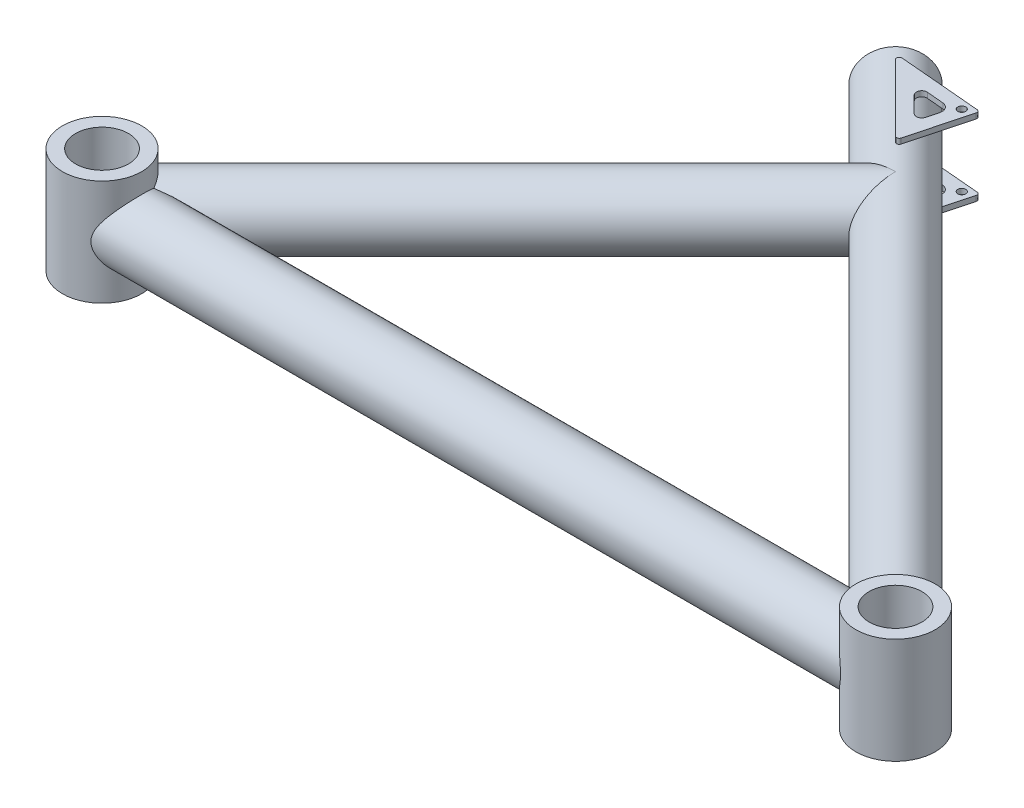
from build123d import *

# Parameters (mm, degrees)
CROQUIS1_R              = 15
SALIENTE_EXTRUIR1_DEPTH = 20
CROQUIS9_R              = 15
SALIENTE_EXTRUIR5_DEPTH = 20
CROQUIS10_W             = 300
CROQUIS10_H             = 12.5
CROQUIS12_R             = 12.5
SALIENTE_EXTRUIR6_DEPTH = 270
CROQUIS18_R             = 10
CORTAR_EXTRUIR1_DEPTH   = 376.137474949
CROQUIS19_R             = 1.5
SALIENTE_EXTRUIR7_DEPTH = 2
REDONDEO1_R             = 1
CROQUIS20_R             = 1.5
SALIENTE_EXTRUIR8_DEPTH = 2
CROQUIS21_R             = 7.5
CORTAR_EXTRUIR2_DEPTH   = 250


with BuildPart() as part:
    # Croquis1 → Saliente-Extruir1 (new, symmetric)
    with BuildSketch(Plane(origin=(0, 0, 0), x_dir=(1, 0, 0), z_dir=(0, 1, 0))):
        with Locations(Location((0, 0, 0), (0, 0, 270))):
            Circle(CROQUIS1_R)
    extrude(amount=SALIENTE_EXTRUIR1_DEPTH, both=True)



with BuildPart() as body_2:
    # Croquis9 → Saliente-Extruir5 (new, symmetric)
    with BuildSketch(Plane(origin=(0, 0, 0), x_dir=(1, 0, 0), z_dir=(0, 1, 0))):
        with Locations(Location((300, 0, 0), (0, 0, 270))):
            Circle(CROQUIS9_R)
    extrude(amount=SALIENTE_EXTRUIR5_DEPTH, both=True)


with BuildPart() as part_1:
    add(part.part)

    add(body_2.part)  # Revolución1 merges body 2
    # Croquis10 → Revolución1 (revolve)
    with BuildSketch(Plane.XY, mode=Mode.PRIVATE) as revoluci_n1_sk:
        with Locations((150, 6.25)):
            Rectangle(CROQUIS10_W, CROQUIS10_H)
    revolve(revoluci_n1_sk.sketch.rotate(Axis((0, 0, 0), (1, 0, 0)), 90), axis=Axis((0, 0, 0), (1, 0, 0)))

    # Croquis12 → Saliente-Extruir6 (add)
    with BuildSketch(Plane(origin=(150, 0, 150), x_dir=(-0.7071067811865456, 0, 0.7071067811865495), z_dir=(-0.7071067811865495, 0, -0.7071067811865456))):
        with Locations(Location((-212.132034356, 0, 0), (0, 0, 297.336794427))):
            Circle(CROQUIS12_R)
    extrude(amount=SALIENTE_EXTRUIR6_DEPTH)

    # Croquis17 → Revolución2 (revolve)
    with BuildSketch(Plane(origin=(0, 0, 0), x_dir=(1, 0, 0), z_dir=(0, 1, 0)), mode=Mode.PRIVATE) as revoluci_n2_sk:
        Polygon((-8.838834765, 8.838834765), (0, 0), (150, 150), (141.161165235, 158.838834765), align=None)
    revolve(revoluci_n2_sk.sketch.rotate(Axis((150, 0, -150), (-0.7071067811865455, 0, 0.7071067811865497)), 117.336794427), axis=Axis((150, 0, -150), (-0.7071067811865455, 0, 0.7071067811865497)))

    # Croquis18 → Cortar-Extruir1 (cut, through all)
    with BuildSketch(Plane(origin=(0, 20, 0), x_dir=(1, 0, 0), z_dir=(0, 1, 0))):
        with Locations(Location((0, 0, 0), (0, 0, 270))):
            Circle(CROQUIS18_R)
        with Locations(Location((300, 0, 0), (0, 0, 270))):
            Circle(CROQUIS18_R)
    extrude(amount=-CORTAR_EXTRUIR1_DEPTH, mode=Mode.SUBTRACT)

    # Croquis21 → Cortar-Extruir2 (cut)
    with BuildSketch(Plane(origin=(-40.91883092, 0, -40.91883092), x_dir=(-0.7071067811865456, 0, 0.7071067811865495), z_dir=(-0.7071067811865495, 0, -0.7071067811865456))):
        with Locations((-212.132034356, 0)):
            Circle(CROQUIS21_R)
    extrude(amount=-CORTAR_EXTRUIR2_DEPTH, mode=Mode.SUBTRACT)


with BuildPart() as body_2_2:
    # Croquis19 → Saliente-Extruir7 (new body)
    with BuildSketch(Plane(origin=(0, 12.5, 0), x_dir=(1, 0, 0), z_dir=(0, 1, 0))):
        Polygon((141.608081014, 158.391918986), (113.323809767, 186.676190233), (148.323809767, 183.61408701), align=None)
        with Locations(Location((144.077563746, 180.974125887, 0), (0, 0, 270))):
            Circle(CROQUIS19_R, mode=Mode.SUBTRACT)
        with BuildLine():
            Line((132.047188122, 180.019007697), (138.405447562, 179.462732076))
            ThreePointArc((138.405447562, 179.462732076), (140.600081534, 178.196810716), (141.042976329, 175.702252769))
            Line((141.042976329, 175.702252769), (139.90167578, 171.415886345))
            ThreePointArc((139.90167578, 171.415886345), (138.488170033, 169.999039468), (136.55479822, 170.516269591))
            Line((136.55479822, 170.516269591), (130.458663074, 176.612404738))
            ThreePointArc((130.458663074, 176.612404738), (130.060261062, 178.871854824), (132.047188122, 180.019007697))
        make_face(mode=Mode.SUBTRACT)
    extrude(amount=SALIENTE_EXTRUIR7_DEPTH)

    # Redondeo1
    redondeo1_edges = [body_2_2.edges().sort_by_distance(p)[0] for p in [
        (113.323809767, 13.5, -186.676190233),
        (148.323809767, 13.5, -183.61408701),
        (141.608081014, 13.5, -158.391918986),
    ]]
    fillet(redondeo1_edges, radius=REDONDEO1_R)


with BuildPart() as body_3:
    # Croquis20 → Saliente-Extruir8 (new body)
    with BuildSketch(Plane(origin=(0, -12.5, 0), x_dir=(-1, 0, 0), z_dir=(0, -1, 0))):
        with BuildLine():
            Line((-116.060832205, 186.436731798), (-147.13848683, 183.717789329))
            ThreePointArc((-147.13848683, 183.717789329), (-147.870031487, 183.295815543), (-148.017663086, 182.464296227))
            Line((-148.017663086, 182.464296227), (-142.05454598, 160.068701177))
            ThreePointArc((-142.05454598, 160.068701177), (-141.347793106, 159.360277738), (-140.3811072, 159.6188928))
            Line((-140.3811072, 159.6188928), (-115.266569681, 184.733430319))
            ThreePointArc((-115.266569681, 184.733430319), (-115.067368675, 185.863155362), (-116.060832205, 186.436731798))
        make_face()
        with Locations(Location((-144.077563746, 180.974125887, 0), (0, 0, 90))):
            Circle(CROQUIS20_R, mode=Mode.SUBTRACT)
        with BuildLine():
            ThreePointArc((-130.458663074, 176.612404738), (-130.060261062, 178.871854824), (-132.047188122, 180.019007697))
            Line((-132.047188122, 180.019007697), (-138.405447562, 179.462732076))
            ThreePointArc((-138.405447562, 179.462732076), (-140.600081534, 178.196810716), (-141.042976329, 175.702252769))
            Line((-141.042976329, 175.702252769), (-139.90167578, 171.415886345))
            ThreePointArc((-139.90167578, 171.415886345), (-138.488170033, 169.999039468), (-136.55479822, 170.516269591))
            Line((-136.55479822, 170.516269591), (-130.458663074, 176.612404738))
        make_face(mode=Mode.SUBTRACT)
    extrude(amount=SALIENTE_EXTRUIR8_DEPTH)


solid = Compound([part_1.part, body_2_2.part, body_3.part])
